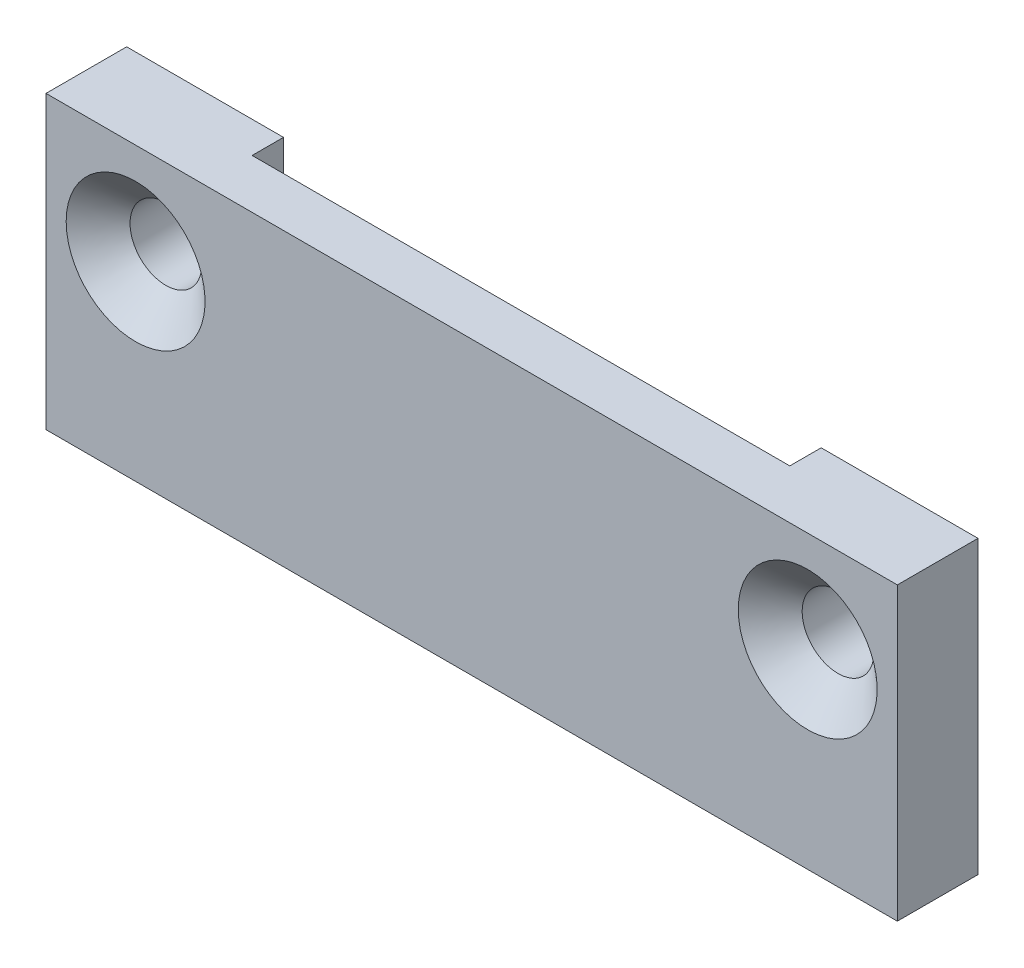
from build123d import *

# Parameters (mm, degrees)
SKETCH1_W           = 38
SKETCH1_H           = 13
SKETCH1_R           = 1.6
BOSS_EXTRUDE1_DEPTH = 3.6
SKETCH2_W           = 24
SKETCH2_H           = 1.4
CUT_EXTRUDE1_DEPTH  = 24.301502098
CHAMFER1_SIZE       = 1.5
CHAMFER1_SIZE2      = 1.350606066


with BuildPart() as part:
    # Sketch1 → Boss-Extrude1 (new body)
    with BuildSketch(Plane.XY):
        Rectangle(SKETCH1_W, SKETCH1_H)
        with Locations((-15, 2)):
            Circle(SKETCH1_R, mode=Mode.SUBTRACT)
        with Locations(Location((15, 2, 0), (0, 0, 180))):
            Circle(SKETCH1_R, mode=Mode.SUBTRACT)
    extrude(amount=BOSS_EXTRUDE1_DEPTH)

    # Sketch2 → Cut-Extrude1 (cut, through all)
    with BuildSketch(Plane(origin=(0, 6.5, 0), x_dir=(1, 0, 0), z_dir=(0, 1, 0))):
        with Locations((0, -0.7)):
            Rectangle(SKETCH2_W, SKETCH2_H)
    extrude(amount=-CUT_EXTRUDE1_DEPTH, mode=Mode.SUBTRACT)

    # Chamfer1
    chamfer1_edges = [part.edges().sort_by_distance(p)[0] for p in [
        (-16.6, 2, 3.6),
        (16.6, 2, 3.6),
    ]]
    chamfer1_side = [part.faces().sort_by_distance(p)[0] for p in [
        (0, -0.067313028, 3.6),
    ]]
    chamfer(chamfer1_edges, length=CHAMFER1_SIZE, length2=CHAMFER1_SIZE2, reference=chamfer1_side[0])


solid = part.part
